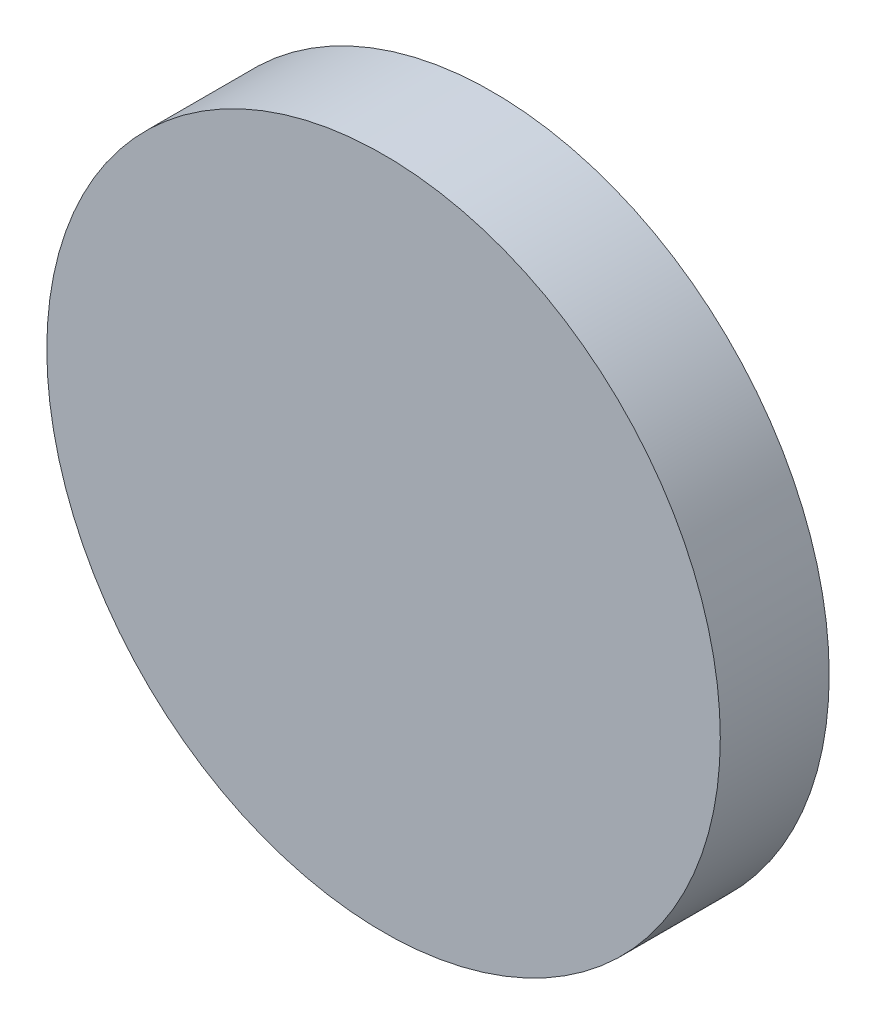
from build123d import *

# Parameters (mm, degrees)
SKETCH1_R           = 47.914127495
BOSS_EXTRUDE1_DEPTH = 15.494


with BuildPart() as part:
    # Sketch1 → Boss-Extrude1 (new body)
    with BuildSketch(Plane.XY):
        Circle(SKETCH1_R)
    extrude(amount=BOSS_EXTRUDE1_DEPTH)


solid = part.part
